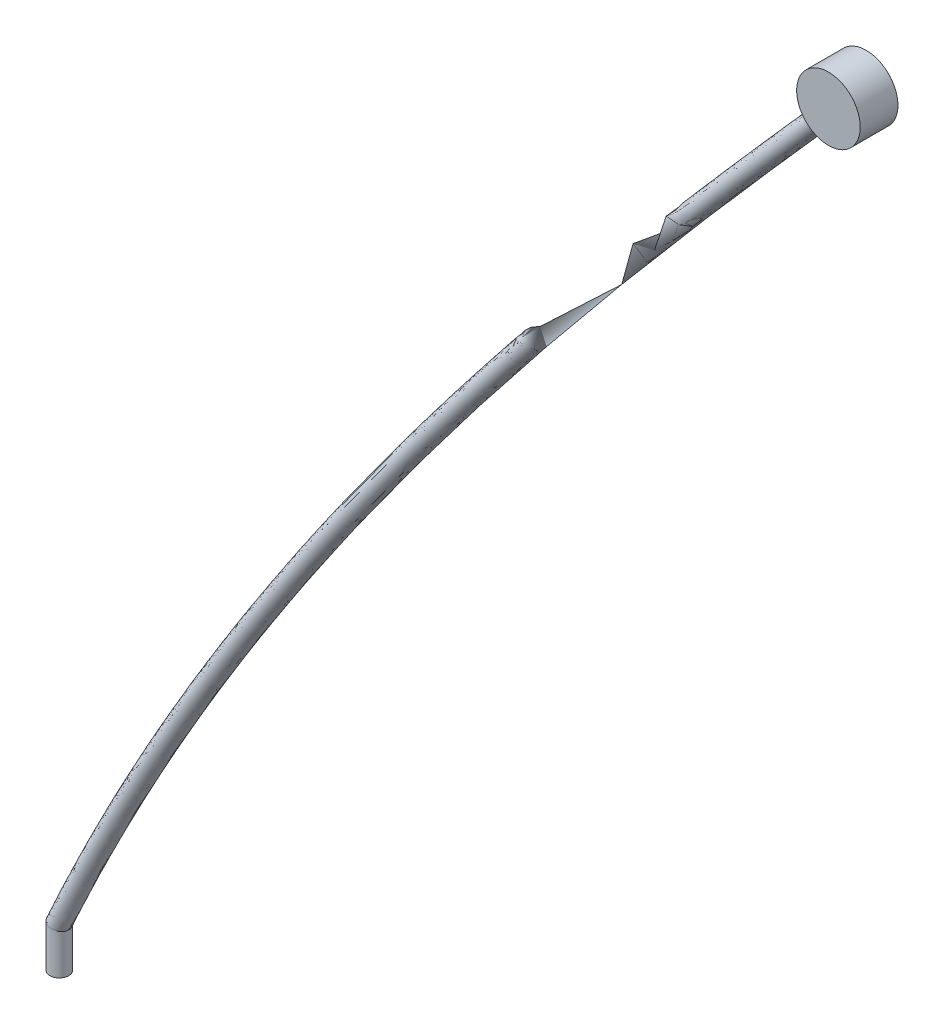
from build123d import *

# Parameters (mm, degrees)
SWEEP1_PROFILE_R    = 0.5
SKETCH22_R          = 1.686433837
BOSS_EXTRUDE1_DEPTH = 1


with BuildPart() as part:
    # Sweep1: sweep along a path in Sketch1
    with BuildLine() as sweep1_path:  # in the path sketch's own coordinates; laid on its plane below (add() does not lay a ready-made edge on the line's plane)
        Line((0, -2.212208583), (0, 0))
        add(Edge.make_bspline(
            [(0, 0), (9.762155267, 21.528729543), (25.299827888, 40.219087935), (40.854531803, 57.689062495)],
            knots=[0, 0, 0, 0, 1, 1, 1, 1], degree=3))
    # Sweep1 profile (on start of the path) → Sweep1 (sweep)
    with BuildSketch(Plane.ZX.offset(-2.212208583)):
        Circle(SWEEP1_PROFILE_R)
    sweep(path=Plane.XY * sweep1_path.line, transition=Transition.RIGHT)

    # Sketch22 → Boss-Extrude1 (add, symmetric)
    with BuildSketch(Plane.XY):
        with Locations((41.792577317, 58.759388873)):
            Circle(SKETCH22_R)
    extrude(amount=BOSS_EXTRUDE1_DEPTH, both=True)


solid = part.part
